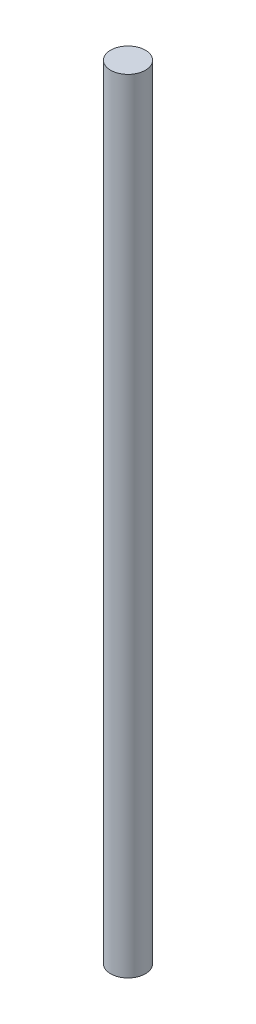
from build123d import *

# Parameters (mm, degrees)
IZIM1_R                     = 2
Y_KSEKLIK_EKSTR_ZYON1_DEPTH = 90


with BuildPart() as part:
    # Çizim1 → Yükseklik-Ekstrüzyon1 (new body)
    with BuildSketch(Plane(origin=(0, 0, 0), x_dir=(1, 0, 0), z_dir=(0, 1, 0))):
        with Locations(Location((0, 0, 0), (0, 0, 90))):
            Circle(IZIM1_R)
    extrude(amount=Y_KSEKLIK_EKSTR_ZYON1_DEPTH)


solid = part.part
